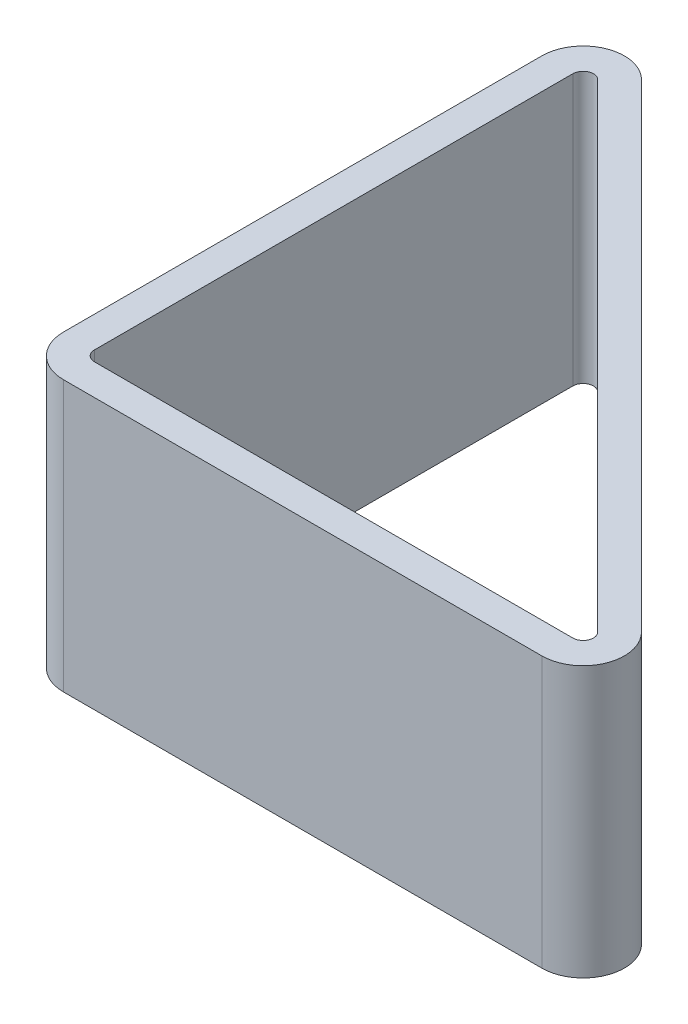
from build123d import *

# Parameters (mm, degrees)
EXTRUDE1_DEPTH = 33.274


with BuildPart() as part:
    # Sketch1 → Extrude1 (new body)
    with BuildSketch(Plane(origin=(0, 0, 0), x_dir=(1, 0, 0), z_dir=(0, 1, 0))):
        with BuildLine():
            Line((-46.765869926, 36.668915011), (-46.765869926, -22.186880092))
            ThreePointArc((-46.765869926, -22.186880092), (-45.277972374, -25.778982541), (-41.685869926, -27.266880092))
            Line((-41.685869926, -27.266880092), (17.169925177, -27.266880092))
            ThreePointArc((17.169925177, -27.266880092), (21.863233202, -24.130911929), (20.762027626, -18.594777644))
            Line((20.762027626, -18.594777644), (-38.093767478, 40.261017459))
            ThreePointArc((-38.093767478, 40.261017459), (-43.629901762, 41.362223036), (-46.765869926, 36.668915011))
        make_face()
        with BuildLine():
            Line((-42.955869926, 36.668915011), (-42.955869926, -22.186880092))
            ThreePointArc((-42.955869926, -22.186880092), (-42.583895538, -23.084905705), (-41.685869926, -23.456880092))
            Line((-41.685869926, -23.456880092), (17.169925177, -23.456880092))
            ThreePointArc((17.169925177, -23.456880092), (18.343252183, -22.672888052), (18.067950789, -21.28885448))
            Line((18.067950789, -21.28885448), (-40.787844314, 37.566940623))
            ThreePointArc((-40.787844314, 37.566940623), (-42.171877885, 37.842242017), (-42.955869926, 36.668915011))
        make_face(mode=Mode.SUBTRACT)
    extrude(amount=EXTRUDE1_DEPTH)


solid = part.part
